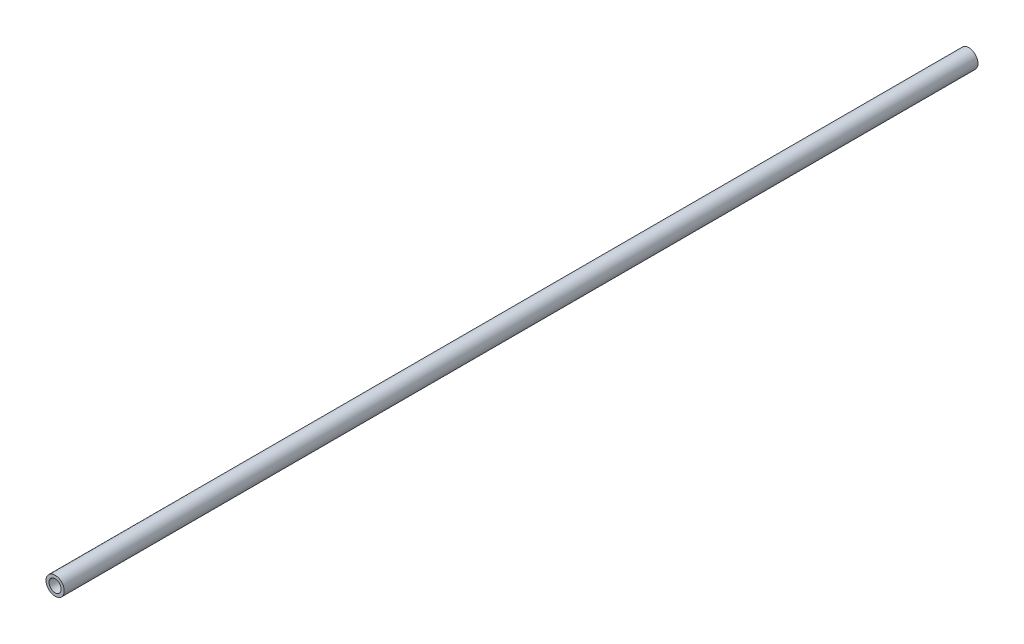
from build123d import *

# Parameters (mm, degrees)
SKIZZE1_R                       = 3
SKIZZE1_R_2                     = 2
AUFSATZ_LINEAR_AUSTRAGEN1_DEPTH = 300


with BuildPart() as part:
    # Skizze1 → Aufsatz-Linear austragen1 (new body)
    with BuildSketch(Plane.XY):
        Circle(SKIZZE1_R)
        Circle(SKIZZE1_R_2, mode=Mode.SUBTRACT)
    extrude(amount=AUFSATZ_LINEAR_AUSTRAGEN1_DEPTH)


solid = part.part
